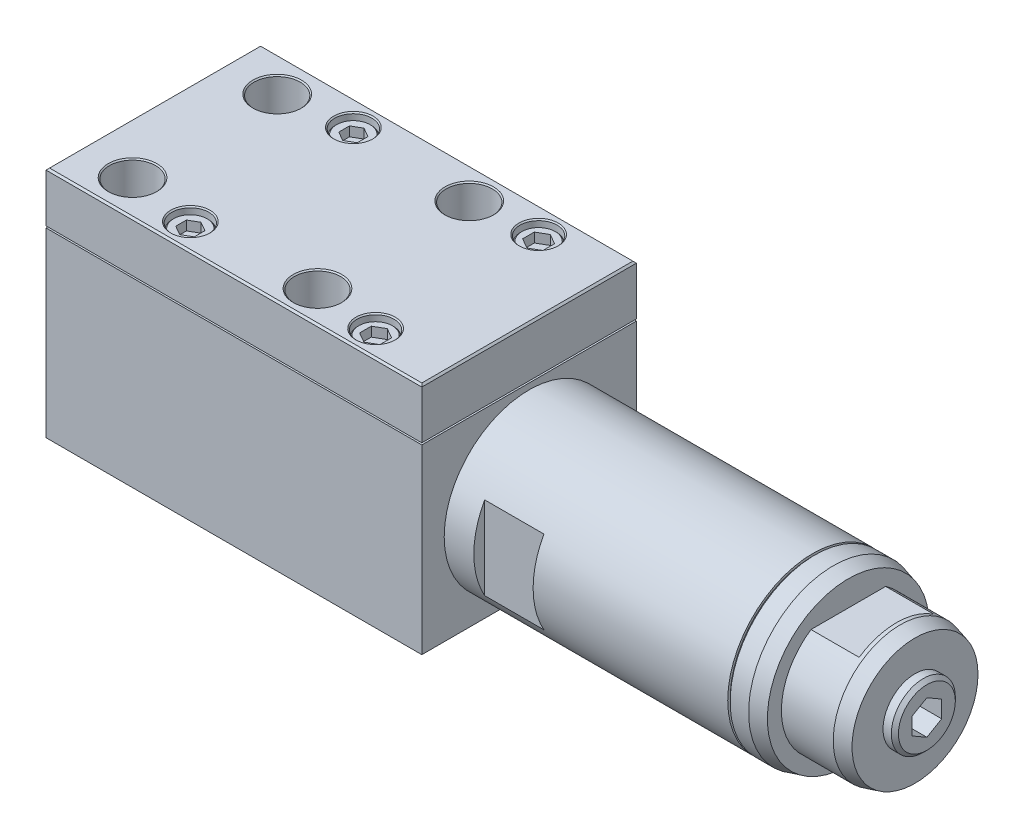
from build123d import *

# Parameters (mm, degrees)
SKETCH2_W               = 80.518
SKETCH2_H               = 38.9255
BOSS_EXTRUDE1_DEPTH     = 22.987
SKETCH3_W               = 80.518
SKETCH3_H               = 45.974
BOSS_EXTRUDE2_DEPTH     = 11.1125
CHAMFER1_SIZE           = 0.381
SKETCH4_R               = 4.953
CUT_EXTRUDE1_DEPTH      = 28.038
SKETCH5_R               = 3.96875
CUT_EXTRUDE2_DEPTH      = 1.27
CHAMFER2_SIZE           = 0.254
SKETCH6_R               = 3.96875
SKETCH6_R_2             = 3.84175
CUT_EXTRUDE_THIN1_DEPTH = 1.27
CHAMFER3_SIZE           = 0.254
CUT_EXTRUDE3_DEPTH      = 2.032
SKETCH8_R               = 2.75
CUT_EXTRUDE4_DEPTH      = 99.439603917
SKETCH9_R               = 3.556
CUT_EXTRUDE5_DEPTH      = 2.54
SKETCH10_R              = 2.159
CUT_EXTRUDE6_DEPTH      = 4
SKETCH17_R              = 18.19275
BOSS_EXTRUDE4_DEPTH     = 85.217
SKETCH13_R              = 6.858
BOSS_EXTRUDE3_DEPTH     = 2.54
CHAMFER4_SIZE           = 0.762
CUT_EXTRUDE8_DEPTH      = 5.08
SKETCH18_OUTSIDE_W      = 84.27
SKETCH18_OUTSIDE_H      = 88.334
SKETCH18_OUTSIDE_R      = 6.858
CUT_EXTRUDE10_DEPTH     = 2.54
CUT_EXTRUDE11_DEPTH     = 5.08
CHAMFER5_SIZE           = 0.762
CUT_EXTRUDE12_DEPTH     = 10.3124
CUT_EXTRUDE13_START     = 6.35
CUT_EXTRUDE13_DEPTH     = 12.7


with BuildPart() as part:
    # Sketch2 → Boss-Extrude1 (new, symmetric)
    with BuildSketch(Plane.XY):
        with Locations((-41.3385, 19.46275)):
            Rectangle(SKETCH2_W, SKETCH2_H)
    extrude(amount=BOSS_EXTRUDE1_DEPTH, both=True)


with BuildPart() as body_2:
    # Sketch3 → Boss-Extrude2 (new body)
    with BuildSketch(Plane(origin=(0, 38.9255, 0), x_dir=(1, 0, 0), z_dir=(0, 1, 0))):
        with Locations((-41.3385, 0)):
            Rectangle(SKETCH3_W, SKETCH3_H)
    extrude(amount=BOSS_EXTRUDE2_DEPTH)

    # Chamfer1
    chamfer1_edges = [body_2.edges().sort_by_distance(p)[0] for p in [
        (-81.5975, 50.038, 0),
        (-41.3385, 50.038, 22.987),
        (-1.0795, 50.038, 0),
        (-41.3385, 38.9255, 22.987),
        (-81.5975, 38.9255, 0),
        (-41.3385, 38.9255, -22.987),
        (-1.0795, 38.9255, 0),
        (-41.3385, 50.038, -22.987),
    ]]
    chamfer(chamfer1_edges, length=CHAMFER1_SIZE)


with BuildPart() as part_1:
    add(part.part)

    # Combine1: union body 2
    add(body_2.part)

    # Sketch4 → Cut-Extrude1 (cut)
    with BuildSketch(Plane(origin=(0, 50.038, 0), x_dir=(1, 0, 0), z_dir=(0, 1, 0))):
        with Locations(Location((-70.5485, 15.494, 0), (0, 0, 270))):
            Circle(SKETCH4_R)
        with Locations(Location((-30.1625, 16.256, 0), (0, 0, 270))):
            Circle(SKETCH4_R)
        with Locations(Location((-70.5485, -15.494, 0), (0, 0, 270))):
            Circle(SKETCH4_R)
        with Locations(Location((-30.1625, -16.256, 0), (0, 0, 270))):
            Circle(SKETCH4_R)
    extrude(amount=-CUT_EXTRUDE1_DEPTH, mode=Mode.SUBTRACT)

    # Sketch5 → Cut-Extrude2 (cut)
    with BuildSketch(Plane(origin=(0, 50.038, 0), x_dir=(1, 0, 0), z_dir=(0, 1, 0))):
        with Locations(Location((-56.1975, 17.4625, 0), (0, 0, 270))):
            Circle(SKETCH5_R)
        with Locations(Location((-16.51, 17.4625, 0), (0, 0, 270))):
            Circle(SKETCH5_R)
        with Locations(Location((-56.1975, -17.4625, 0), (0, 0, 270))):
            Circle(SKETCH5_R)
        with Locations(Location((-16.51, -17.4625, 0), (0, 0, 270))):
            Circle(SKETCH5_R)
    extrude(amount=-CUT_EXTRUDE2_DEPTH, mode=Mode.SUBTRACT)

    # Chamfer2
    chamfer2_edges = [part_1.edges().sort_by_distance(p)[0] for p in [
        (-70.5485, 50.038, -20.447),
        (-30.1625, 50.038, -21.209),
        (-70.5485, 50.038, 10.541),
        (-30.1625, 50.038, 11.303),
        (-56.1975, 50.038, -21.43125),
        (-16.51, 50.038, -21.43125),
        (-56.1975, 50.038, 13.49375),
        (-16.51, 50.038, 13.49375),
    ]]
    chamfer(chamfer2_edges, length=CHAMFER2_SIZE)

    # Sketch6 → Cut-Extrude-Thin1 (cut)
    # profile 1 of 4: a face of its own
    with BuildSketch(Plane(origin=(0, 48.768, 0), x_dir=(1, 0, 0), z_dir=(0, 1, 0))):
        with Locations((-56.1975, 17.4625)):
            Circle(SKETCH6_R)
        with Locations((-56.1975, 17.4625)):
            Circle(SKETCH6_R_2, mode=Mode.SUBTRACT)
    # profile 2 of 4: a face of its own
    with BuildSketch(Plane(origin=(0, 48.768, 0), x_dir=(1, 0, 0), z_dir=(0, 1, 0))):
        with Locations((-16.51, 17.4625)):
            Circle(SKETCH6_R)
        with Locations((-16.51, 17.4625)):
            Circle(SKETCH6_R_2, mode=Mode.SUBTRACT)
    # profile 3 of 4: a face of its own
    with BuildSketch(Plane(origin=(0, 48.768, 0), x_dir=(1, 0, 0), z_dir=(0, 1, 0))):
        with Locations((-16.51, -17.4625)):
            Circle(SKETCH6_R)
        with Locations((-16.51, -17.4625)):
            Circle(SKETCH6_R_2, mode=Mode.SUBTRACT)
    # profile 4 of 4: a face of its own
    with BuildSketch(Plane(origin=(0, 48.768, 0), x_dir=(1, 0, 0), z_dir=(0, 1, 0))):
        with Locations((-56.1975, -17.4625)):
            Circle(SKETCH6_R)
        with Locations((-56.1975, -17.4625)):
            Circle(SKETCH6_R_2, mode=Mode.SUBTRACT)
    extrude(amount=-CUT_EXTRUDE_THIN1_DEPTH, mode=Mode.SUBTRACT)

    # Chamfer3
    chamfer3_edges = [part_1.edges().sort_by_distance(p)[0] for p in [
        (-20.35175, 48.768, -17.4625),
        (-20.35175, 48.768, 17.4625),
        (-60.03925, 48.768, 17.4625),
        (-60.03925, 48.768, -17.4625),
    ]]
    chamfer(chamfer3_edges, length=CHAMFER3_SIZE)

    # Sketch7 → Cut-Extrude3 (cut)
    with BuildSketch(Plane(origin=(0, 48.768, 0), x_dir=(1, 0, 0), z_dir=(0, 1, 0))):
        Polygon((-56.1975, 19.750192707), (-58.1787, 18.606346353), (-58.1787, 16.318653647), (-56.1975, 15.174807293), (-54.2163, 16.318653647), (-54.2163, 18.606346353), align=None)
        Polygon((-56.1975, -15.174807293), (-58.1787, -16.318653647), (-58.1787, -18.606346353), (-56.1975, -19.750192707), (-54.2163, -18.606346353), (-54.2163, -16.318653647), align=None)
        Polygon((-16.51, -14.958811275), (-18.678258039, -16.210655638), (-18.678258039, -18.714344362), (-16.51, -19.966188725), (-14.341741961, -18.714344362), (-14.341741961, -16.210655638), align=None)
        Polygon((-16.51, 19.966188725), (-18.678258039, 18.714344362), (-18.678258039, 16.210655638), (-16.51, 14.958811275), (-14.341741961, 16.210655638), (-14.341741961, 18.714344362), align=None)
    extrude(amount=-CUT_EXTRUDE3_DEPTH, mode=Mode.SUBTRACT)

    # Sketch8 → Cut-Extrude4 (cut, through all)
    with BuildSketch(Plane(origin=(0, 50.038, 0), x_dir=(1, 0, 0), z_dir=(0, 1, 0))):
        with Locations(Location((-70.5485, 15.494, 0), (0, 0, 270))):
            Circle(SKETCH8_R)
        with Locations(Location((-30.1625, 16.256, 0), (0, 0, 270))):
            Circle(SKETCH8_R)
        with Locations(Location((-30.1625, -16.256, 0), (0, 0, 270))):
            Circle(SKETCH8_R)
        with Locations(Location((-70.5485, -15.494, 0), (0, 0, 270))):
            Circle(SKETCH8_R)
    extrude(amount=-CUT_EXTRUDE4_DEPTH, mode=Mode.SUBTRACT)

    # Sketch9 → Cut-Extrude5 (cut)
    with BuildSketch(Plane.XZ):
        with Locations(Location((-48.9585, 10.414, 0), (0, 0, 270))):
            Circle(SKETCH9_R)
        with Locations(Location((-48.9585, -10.414, 0), (0, 0, 270))):
            Circle(SKETCH9_R)
        with Locations(Location((-57.8485, 0, 0), (0, 0, 270))):
            Circle(SKETCH9_R)
        with Locations(Location((-40.3225, 0, 0), (0, 0, 270))):
            Circle(SKETCH9_R)
    extrude(amount=-CUT_EXTRUDE5_DEPTH, mode=Mode.SUBTRACT)

    # Sketch10 → Cut-Extrude6 (cut)
    with BuildSketch(Plane.XZ):
        with Locations(Location((-37.5285, 15.494, 0), (0, 0, 270))):
            Circle(SKETCH10_R)
    extrude(amount=-CUT_EXTRUDE6_DEPTH, mode=Mode.SUBTRACT)

    # Cut-Extrude7 cone 1 section (through the dimple's axis) → Cut-Extrude7 (revolve, cut)
    with BuildSketch(Plane(origin=(-48.9585, 2.54, 10.414), x_dir=(0, 0, -1), z_dir=(1, 0, 0))):
        Polygon((0, 0), (3.556, 0), (0, 3.556), align=None)
    revolve(axis=Axis((-48.9585, 2.54, 10.414), (0, 1, 0)), mode=Mode.SUBTRACT)

    # Cut-Extrude7 cone 2 section (through the dimple's axis) → Cut-Extrude7 cone 2 (revolve, cut)
    with BuildSketch(Plane(origin=(-40.3225, 2.54, 0), x_dir=(0, 0, -1), z_dir=(1, 0, 0))):
        Polygon((0, 0), (3.556, 0), (0, 3.556), align=None)
    revolve(axis=Axis((-40.3225, 2.54, 0), (0, 1, 0)), mode=Mode.SUBTRACT)

    # Cut-Extrude7 cone 3 section (through the dimple's axis) → Cut-Extrude7 cone 3 (revolve, cut)
    with BuildSketch(Plane(origin=(-57.8485, 2.54, 0), x_dir=(0, 0, -1), z_dir=(1, 0, 0))):
        Polygon((0, 0), (3.556, 0), (0, 3.556), align=None)
    revolve(axis=Axis((-57.8485, 2.54, 0), (0, 1, 0)), mode=Mode.SUBTRACT)

    # Cut-Extrude7 cone 4 section (through the dimple's axis) → Cut-Extrude7 cone 4 (revolve, cut)
    with BuildSketch(Plane(origin=(-48.9585, 2.54, -10.414), x_dir=(0, 0, -1), z_dir=(1, 0, 0))):
        Polygon((0, 0), (3.556, 0), (0, 3.556), align=None)
    revolve(axis=Axis((-48.9585, 2.54, -10.414), (0, 1, 0)), mode=Mode.SUBTRACT)

    # Sketch17 → Boss-Extrude4 (add)
    with BuildSketch(Plane(origin=(-1.0795, 0, 0), x_dir=(0, 0, -1), z_dir=(1, 0, 0))):
        with Locations(Location((0, 19.46275, 0), (0, 0, 180))):
            Circle(SKETCH17_R)
    extrude(amount=BOSS_EXTRUDE4_DEPTH)

    # Sketch13 → Boss-Extrude3 (add)
    with BuildSketch(Plane.ZY.offset(81.5975)):
        with Locations(Location((0, 19.46275, 0), (0, 0, 180))):
            Circle(SKETCH13_R)
    extrude(amount=BOSS_EXTRUDE3_DEPTH)

    # Chamfer4
    chamfer4_edges = [part_1.edges().sort_by_distance(p)[0] for p in [
        (-84.1375, 19.46275, 6.858),
    ]]
    chamfer(chamfer4_edges, length=CHAMFER4_SIZE)

    # Sketch14 → Cut-Extrude8 (cut)
    with BuildSketch(Plane.ZY.offset(84.1375)):
        Polygon((0, 23.128924209), (-3.175, 21.295837105), (-3.175, 17.629662895), (0, 15.796575791), (3.175, 17.629662895), (3.175, 21.295837105), align=None)
    extrude(amount=-CUT_EXTRUDE8_DEPTH, mode=Mode.SUBTRACT)

    # Cut-Extrude9 cone 1 section (through the dimple's axis) → Cut-Extrude9 (revolve, cut)
    with BuildSketch(Plane(origin=(-84.1375, 19.46275, 0), x_dir=(0, 0, 1), z_dir=(0, 1, 0))):
        Polygon((0, 0), (3.666174209, 0), (0, 3.666174209), align=None)
    revolve(axis=Axis((-84.1375, 19.46275, 0), (1, 0, 0)), mode=Mode.SUBTRACT)

    # Sketch18 outside → Cut-Extrude10 (cut)
    with BuildSketch(Plane(origin=(84.1375, 0, 0), x_dir=(0, 0, -1), z_dir=(1, 0, 0))):
        with Locations((0, 25.019)):
            Rectangle(SKETCH18_OUTSIDE_W, SKETCH18_OUTSIDE_H)
        with Locations((0, 19.46275)):
            Circle(SKETCH18_OUTSIDE_R, mode=Mode.SUBTRACT)
    extrude(amount=-CUT_EXTRUDE10_DEPTH, mode=Mode.SUBTRACT)

    # Sketch19 → Cut-Extrude11 (cut)
    with BuildSketch(Plane(origin=(84.1375, 0, 0), x_dir=(0, 0, -1), z_dir=(1, 0, 0))):
        Polygon((3.175, 21.295837105), (0, 23.128924209), (-3.175, 21.295837105), (-3.175, 17.629662895), (0, 15.796575791), (3.175, 17.629662895), align=None)
    extrude(amount=-CUT_EXTRUDE11_DEPTH, mode=Mode.SUBTRACT)

    # Chamfer5
    chamfer5_edges = [part_1.edges().sort_by_distance(p)[0] for p in [
        (84.1375, 19.46275, 6.858),
    ]]
    chamfer(chamfer5_edges, length=CHAMFER5_SIZE)

    # Sketch20 → Cut-Revolve1 (revolve, cut)
    with BuildSketch(Plane.XY, mode=Mode.PRIVATE) as cut_revolve1_sk:
        Polygon((81.5975, 32.9565), (78.4225, 33.807238686), (67.31, 33.807238686), (67.31, 36.804761314), (64.135, 37.6555), (60.1726, 37.6555), (60.1726, 37.1475), (59.6646, 37.1475), (59.6646, 40.8305), (81.5975, 40.8305), align=None)
    revolve(cut_revolve1_sk.sketch.rotate(Axis((83.3755, 19.46275, 0), (-1, 0, 0)), 90), axis=Axis((83.3755, 19.46275, 0), (-1, 0, 0)), mode=Mode.SUBTRACT)

    # Sketch21 → Cut-Extrude12 (cut)
    with BuildSketch(Plane(origin=(67.31, 0, 0), x_dir=(0, 0, -1), z_dir=(1, 0, 0))):
        with BuildLine():
            Line((8.000347905, 7.5565), (-8.000347905, 7.5565))
            ThreePointArc((-8.000347905, 7.5565), (0, 5.118261314), (8.000347905, 7.5565))
        make_face()
        with BuildLine():
            Line((-8.000347905, 31.369), (8.000347905, 31.369))
            ThreePointArc((8.000347905, 31.369), (0, 33.807238686), (-8.000347905, 31.369))
        make_face()
    extrude(amount=CUT_EXTRUDE12_DEPTH, mode=Mode.SUBTRACT)

    # Sketch22 → Cut-Extrude13 (cut)
    with BuildSketch(Plane(origin=(-1.0795, 0, 0), x_dir=(0, 0, -1), z_dir=(1, 0, 0)).offset(CUT_EXTRUDE13_START)):
        with BuildLine():
            Line((-15.875, 28.348723642), (-15.875, 10.576776358))
            ThreePointArc((-15.875, 10.576776358), (-18.19275, 19.46275), (-15.875, 28.348723642))
        make_face()
        with BuildLine():
            Line((15.875, 28.348723642), (15.875, 10.576776358))
            ThreePointArc((15.875, 10.576776358), (18.19275, 19.46275), (15.875, 28.348723642))
        make_face()
    extrude(amount=CUT_EXTRUDE13_DEPTH, mode=Mode.SUBTRACT)


solid = part_1.part
